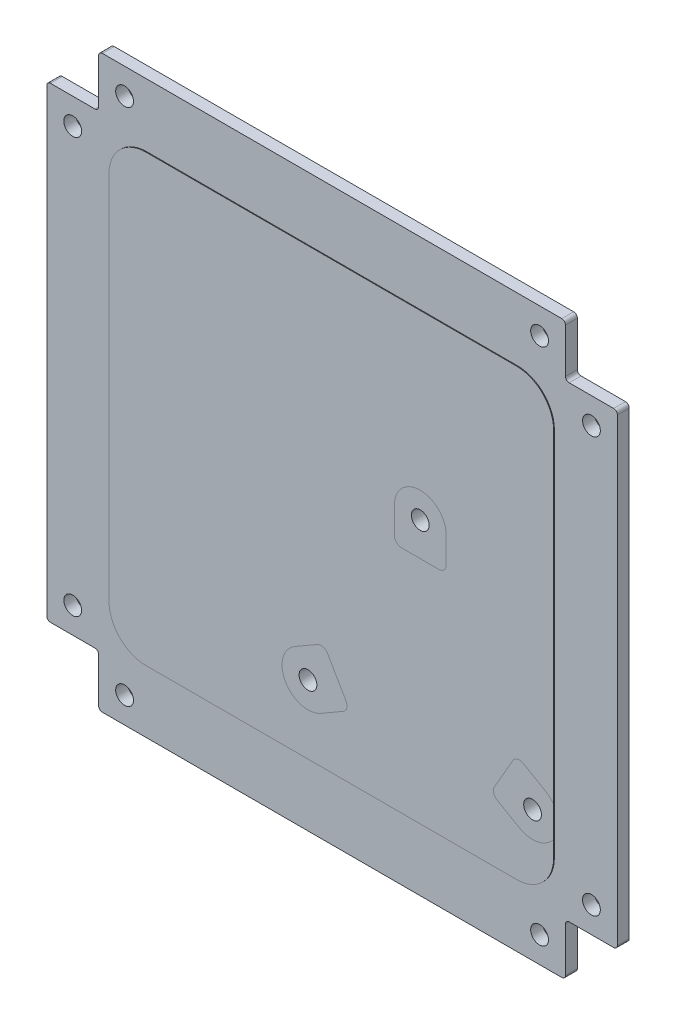
from build123d import *

# Parameters (mm, degrees)
BOSS_EXTRUDE1_DEPTH            = 1.6
BOSS_EXTRUDE2_DEPTH            = 0.1
M2_HOLE1_FIXINGSTRUCTURE_D     = 2.4
M2_HOLE1_FIXINGSTRUCTURE_DEPTH = 200
M2_HOLE1_FIXINGSTRUCTURE_TIP   = 0.721032743
SKETCH5_R                      = 1.2
CUT_EXTRUDE1_DEPTH             = 1.7


with BuildPart() as part:
    # Sketch1 → Boss-Extrude1 (new body)
    with BuildSketch(Plane.XY):
        with BuildLine():
            Line((-31.5, 38), (-31.5, 32))
            ThreePointArc((-31.5, 32), (-31.646446609, 31.646446609), (-32, 31.5))
            Line((-32, 31.5), (-38, 31.5))
            ThreePointArc((-38, 31.5), (-38.353553391, 31.353553391), (-38.5, 31))
            Line((-38.5, 31), (-38.5, -31))
            ThreePointArc((-38.5, -31), (-38.353553391, -31.353553391), (-38, -31.5))
            Line((-38, -31.5), (-32, -31.5))
            ThreePointArc((-32, -31.5), (-31.646446609, -31.646446609), (-31.5, -32))
            Line((-31.5, -32), (-31.5, -38))
            ThreePointArc((-31.5, -38), (-31.353553391, -38.353553391), (-31, -38.5))
            Line((-31, -38.5), (31, -38.5))
            ThreePointArc((31, -38.5), (31.353553391, -38.353553391), (31.5, -38))
            Line((31.5, -38), (31.5, -32))
            ThreePointArc((31.5, -32), (31.646446609, -31.646446609), (32, -31.5))
            Line((32, -31.5), (38, -31.5))
            ThreePointArc((38, -31.5), (38.353553391, -31.353553391), (38.5, -31))
            Line((38.5, -31), (38.5, 31))
            ThreePointArc((38.5, 31), (38.353553391, 31.353553391), (38, 31.5))
            Line((38, 31.5), (32, 31.5))
            ThreePointArc((32, 31.5), (31.646446609, 31.646446609), (31.5, 32))
            Line((31.5, 32), (31.5, 38))
            ThreePointArc((31.5, 38), (31.353553391, 38.353553391), (31, 38.5))
            Line((31, 38.5), (-31, 38.5))
            ThreePointArc((-31, 38.5), (-31.353553391, 38.353553391), (-31.5, 38))
        make_face()
    extrude(amount=BOSS_EXTRUDE1_DEPTH)

    # Esboço1 → Boss-Extrude2 (add)
    with BuildSketch(Plane.XY.offset(1.6)):
        with BuildLine():
            Line((-25, -30), (25, -30))
            ThreePointArc((25, -30), (28.535533906, -28.535533906), (30, -25))
            Line((30, -25), (30, 25))
            ThreePointArc((30, 25), (28.535533906, 28.535533906), (25, 30))
            Line((25, 30), (-25, 30))
            ThreePointArc((-25, 30), (-28.535533906, 28.535533906), (-30, 25))
            Line((-30, 25), (-30, -25))
            ThreePointArc((-30, -25), (-28.535533906, -28.535533906), (-25, -30))
        make_face()
    extrude(amount=BOSS_EXTRUDE2_DEPTH)

    # M2 Hole1-FixingStructure
    with Locations(Plane(origin=(0, 0, 0), x_dir=(-1, 0, 0), z_dir=(0, 0, -1))):
        with Locations((-28, 35), (28, 35), (-28, -35), (28, -35), (35, 28), (35, -28), (-35, -28), (-35, 28)):
            Hole(M2_HOLE1_FIXINGSTRUCTURE_D / 2, depth=M2_HOLE1_FIXINGSTRUCTURE_DEPTH)
            with Locations((0, 0, -(M2_HOLE1_FIXINGSTRUCTURE_DEPTH + M2_HOLE1_FIXINGSTRUCTURE_TIP / 2))):  # 118° drill point
                Cone(0, M2_HOLE1_FIXINGSTRUCTURE_D / 2, M2_HOLE1_FIXINGSTRUCTURE_TIP, mode=Mode.SUBTRACT)

    # Sketch5 → Cut-Extrude1 (cut)
    with BuildSketch(Plane.XY.offset(1.7)):
        with Locations((-3.155444566, -20.75)):
            Circle(SKETCH5_R)
        with Locations((27.155444566, -20.75)):
            Circle(SKETCH5_R)
        with Locations((12, 5.5)):
            Circle(SKETCH5_R)
    extrude(amount=-CUT_EXTRUDE1_DEPTH, mode=Mode.SUBTRACT)


solid = part.part
